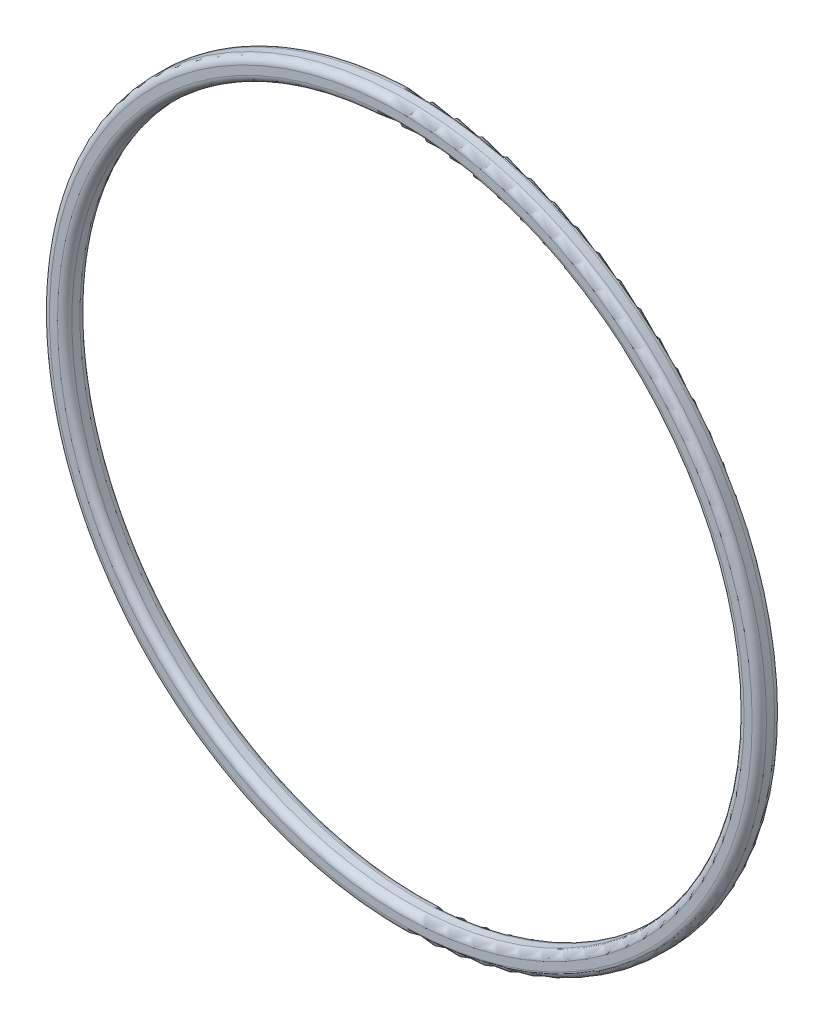
from build123d import *

# Parameters (mm, degrees)
SKETCH1_R           = 25.4
SKETCH1_R_2         = 23.8125
BOSS_EXTRUDE1_DEPTH = 1.5875
FILLET1_R           = 0.508


with BuildPart() as part:
    # Sketch1 → Boss-Extrude1 (new body)
    with BuildSketch(Plane.XY):
        Circle(SKETCH1_R)
        Circle(SKETCH1_R_2, mode=Mode.SUBTRACT)
    extrude(amount=BOSS_EXTRUDE1_DEPTH)

    # Fillet1
    fillet1_edges = [part.edges().sort_by_distance(p)[0] for p in [
        (-25.4, 0, 0),
        (-25.4, 0, 1.5875),
        (-23.8125, 0, 0),
        (-23.8125, 0, 1.5875),
    ]]
    fillet(fillet1_edges, radius=FILLET1_R)


solid = part.part
